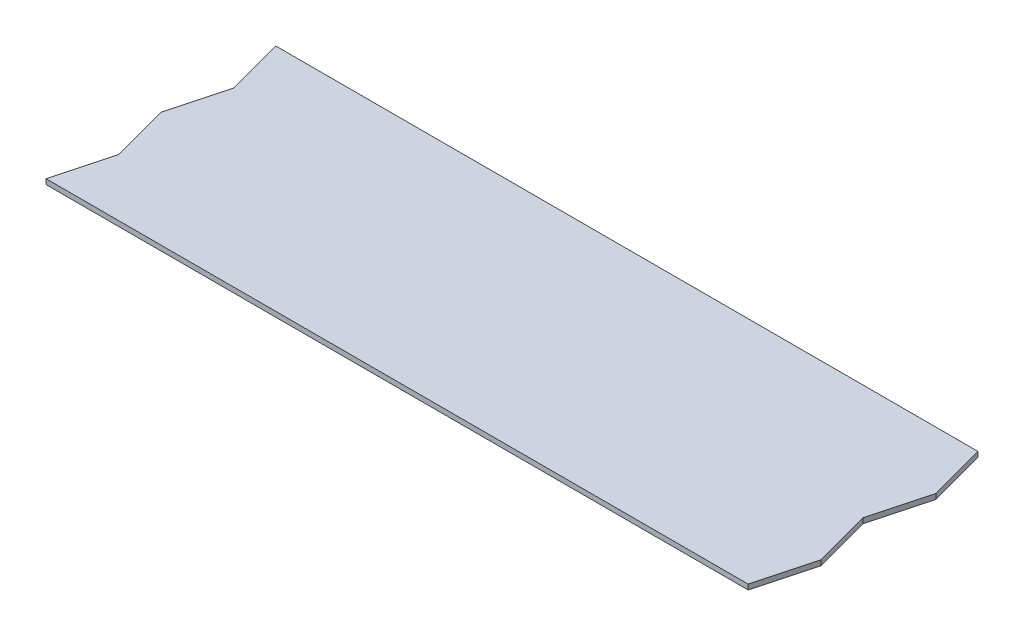
from build123d import *

# Parameters (mm, degrees)
BOSS_EXTRUDE1_DEPTH = 0.4


with BuildPart() as part:
    # Sketch1 → Boss-Extrude1 (new body)
    with BuildSketch(Plane(origin=(0, 0, 0), x_dir=(1, 0, 0), z_dir=(0, 1, 0))):
        Polygon((0, 0), (55, 0), (56.205771366, -4.5), (55, -9), (56.205771366, -13.5), (55, -18), (0, -18), (1.205771366, -13.5), (0, -9), (1.205771366, -4.5), align=None)
    extrude(amount=BOSS_EXTRUDE1_DEPTH)


solid = part.part
